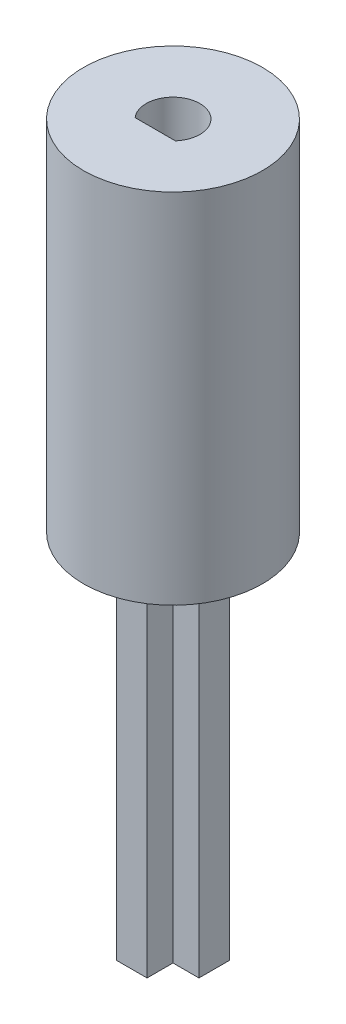
from build123d import *

# Parameters (mm, degrees)
BOSS_EXTRUDE1_DEPTH = 20
SKETCH3_R           = 5
BOSS_EXTRUDE2_DEPTH = 20
CUT_EXTRUDE1_DEPTH  = 10


with BuildPart() as part:
    # Sketch2 → Boss-Extrude1 (new body)
    with BuildSketch(Plane(origin=(0, 0, 0), x_dir=(1, 0, 0), z_dir=(0, 1, 0))):
        Polygon((-0.85, 2.3), (0.85, 2.3), (0.85, 0.85), (2.3, 0.85), (2.3, -0.85), (0.85, -0.85), (0.85, -2.3), (-0.85, -2.3), (-0.85, -0.85), (-2.3, -0.85), (-2.3, 0.85), (-0.85, 0.85), align=None)
    extrude(amount=BOSS_EXTRUDE1_DEPTH)

    # Sketch3 → Boss-Extrude2 (add)
    with BuildSketch(Plane(origin=(0, 20, 0), x_dir=(1, 0, 0), z_dir=(0, 1, 0))):
        with Locations(Location((0, 0, 0), (0, 0, 270))):
            Circle(SKETCH3_R)
    extrude(amount=BOSS_EXTRUDE2_DEPTH)

    # Sketch4 → Cut-Extrude1 (cut)
    with BuildSketch(Plane(origin=(0, 40, 0), x_dir=(1, 0, 0), z_dir=(0, 1, 0))):
        with BuildLine():
            Line((-1.125, -0.992156742), (1.125, -0.992156742))
            ThreePointArc((1.125, -0.992156742), (0, 1.5), (-1.125, -0.992156742))
        make_face()
    extrude(amount=-CUT_EXTRUDE1_DEPTH, mode=Mode.SUBTRACT)


solid = part.part
